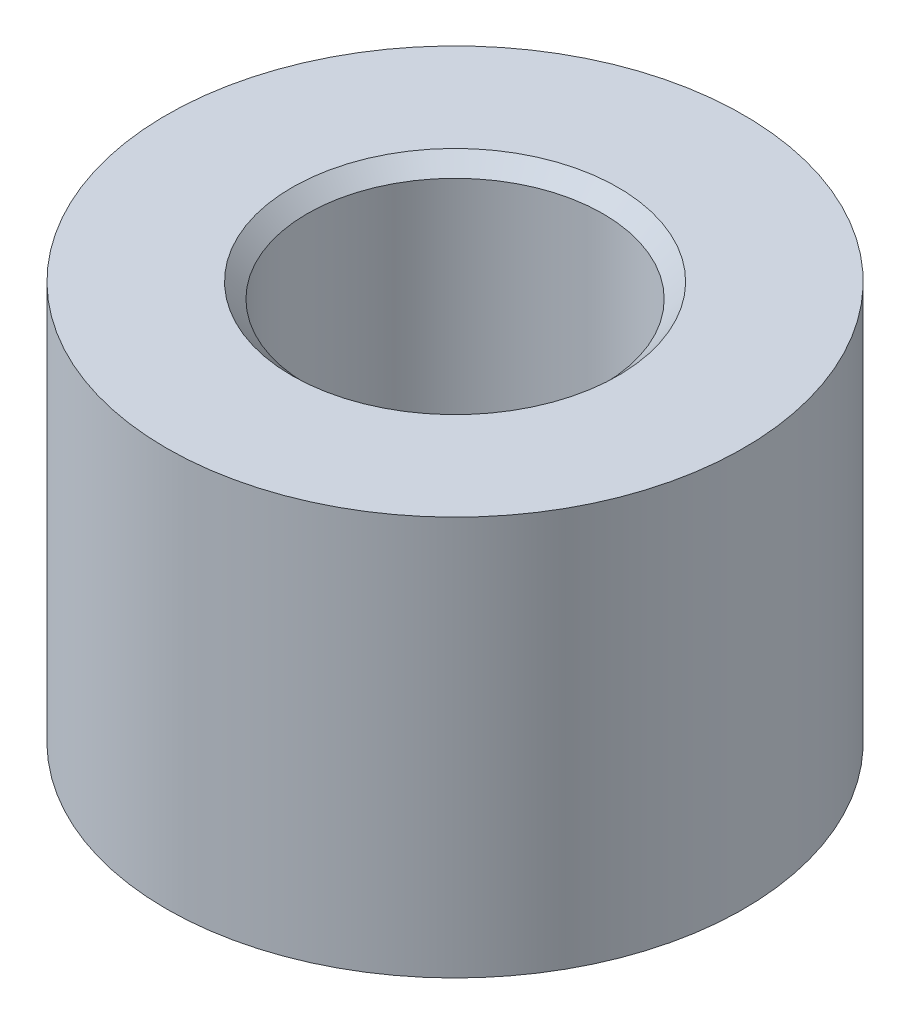
from build123d import *

# Parameters (mm, degrees)
SKETCH1_R           = 3.81
SKETCH1_R_2         = 1.9526
BOSS_EXTRUDE1_DEPTH = 5.2690014
CHAMFER1_SIZE       = 0.2


with BuildPart() as part:
    # Sketch1 → Boss-Extrude1 (new body)
    with BuildSketch(Plane(origin=(0, 0, 0), x_dir=(1, 0, 0), z_dir=(0, 1, 0))):
        with Locations(Location((0, 0, 0), (0, 0, 270))):
            Circle(SKETCH1_R)
        with Locations(Location((0, 0, 0), (0, 0, 270))):
            Circle(SKETCH1_R_2, mode=Mode.SUBTRACT)
    extrude(amount=BOSS_EXTRUDE1_DEPTH)

    # Chamfer1
    chamfer1_edges = [part.edges().sort_by_distance(p)[0] for p in [
        (0, 0, -1.9526),
        (0, 5.2690014, -1.9526),
    ]]
    chamfer(chamfer1_edges, length=CHAMFER1_SIZE)


solid = part.part
